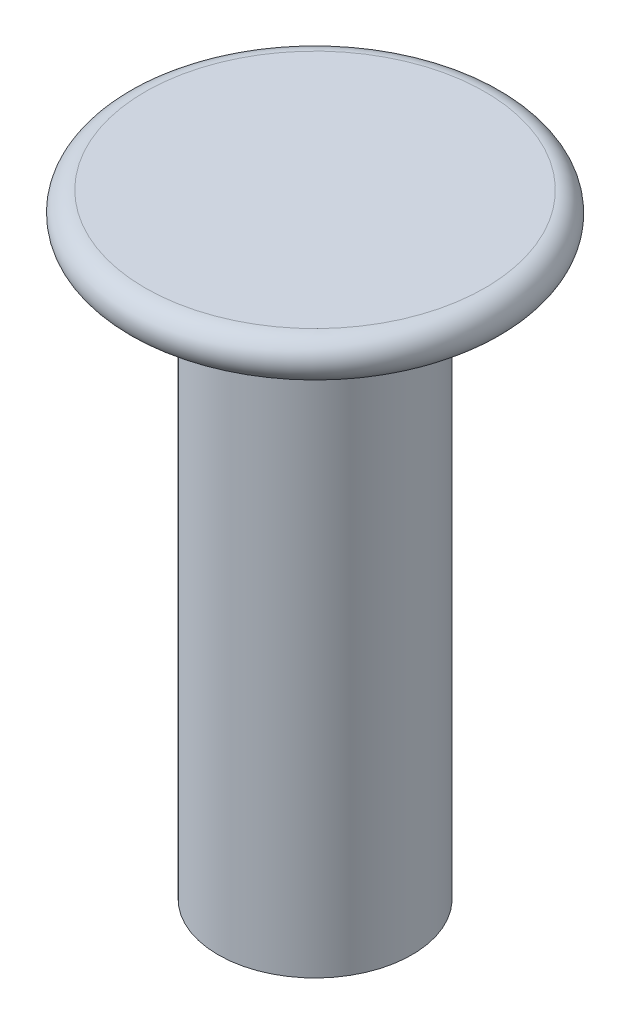
from build123d import *


with BuildPart() as part:
    # Sketch2 → Revolve1 (revolve)
    with BuildSketch(Plane.XY, mode=Mode.PRIVATE) as revolve1_sk:
        with BuildLine():
            Line((1.5875, -1.397), (1.5875, -10.0584))
            Line((1.5875, -10.0584), (0, -10.0584))
            Line((0, -10.0584), (0, 0))
            Line((0, 0), (2.783660204, 0))
            ThreePointArc((2.783660204, 0), (3.10032913, -0.242988613), (2.947580102, -0.611757387))
            Line((2.947580102, -0.611757387), (1.5875, -1.397))
        make_face()
    revolve(revolve1_sk.sketch.rotate(Axis((0, 94.608881441, 0), (0, -1, 0)), 90), axis=Axis((0, 94.608881441, 0), (0, -1, 0)))


solid = part.part
